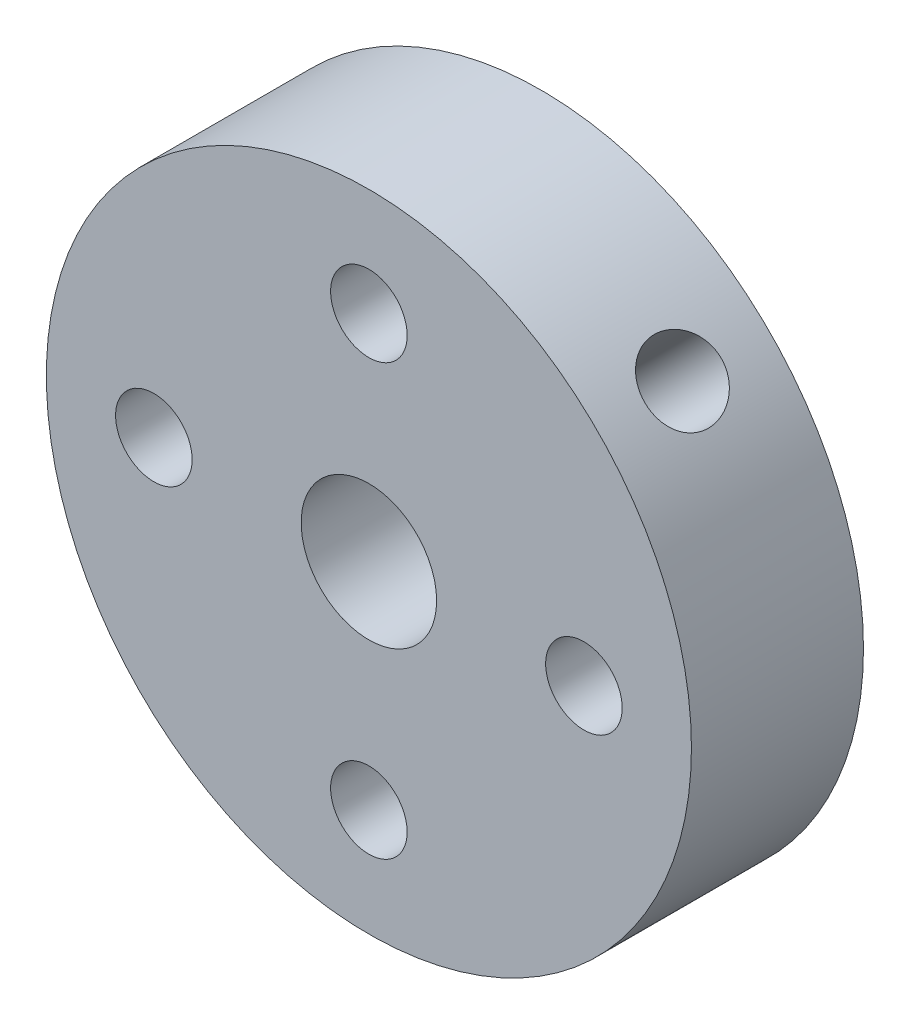
from build123d import *

# Parameters (mm, degrees)
SKETCH1_R           = 9.525
SKETCH1_R_2         = 2
SKETCH1_R_3         = 1.1303
BOSS_EXTRUDE1_DEPTH = 5.08
SKETCH2_R           = 1.1303
CUT_EXTRUDE1_DEPTH  = 10.16


with BuildPart() as part:
    # Sketch1 → Boss-Extrude1 (new body)
    with BuildSketch(Plane.XY):
        Circle(SKETCH1_R)
        Circle(SKETCH1_R_2, mode=Mode.SUBTRACT)
        with Locations((-6.35, 0)):
            Circle(SKETCH1_R_3, mode=Mode.SUBTRACT)
        with Locations((0, 6.35)):
            Circle(SKETCH1_R_3, mode=Mode.SUBTRACT)
        with Locations((6.35, 0)):
            Circle(SKETCH1_R_3, mode=Mode.SUBTRACT)
        with Locations((0, -6.35)):
            Circle(SKETCH1_R_3, mode=Mode.SUBTRACT)
    extrude(amount=BOSS_EXTRUDE1_DEPTH)

    # Sketch2 → Cut-Extrude1 (cut)
    with BuildSketch(Plane(origin=(6.735192091, 6.735192091, 0), x_dir=(-0.7071067811865476, 0.7071067811865476, 0), z_dir=(0.7071067811865476, 0.7071067811865476, 0))):
        with Locations((0, 2.54)):
            Circle(SKETCH2_R)
    extrude(amount=-CUT_EXTRUDE1_DEPTH, mode=Mode.SUBTRACT)


solid = part.part
